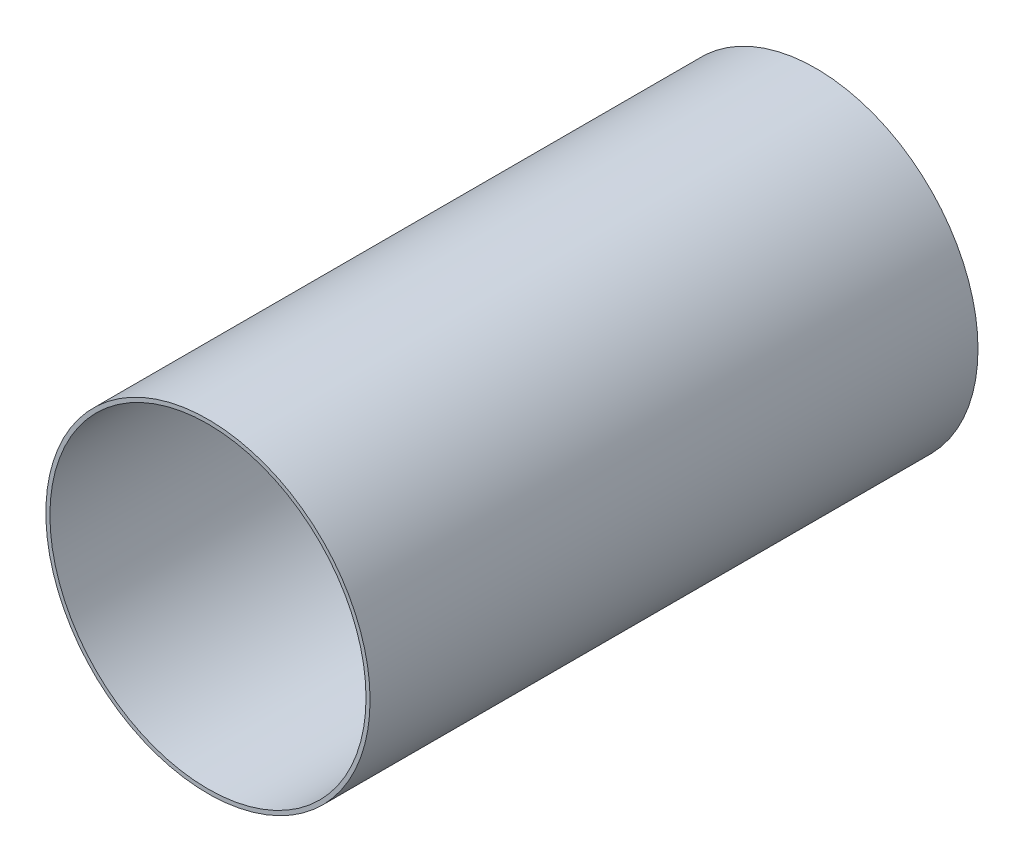
from build123d import *

# Parameters (mm, degrees)
SKETCH1_R           = 80
SKETCH1_R_2         = 78
BOSS_EXTRUDE1_DEPTH = 300


with BuildPart() as part:
    # Sketch1 → Boss-Extrude1 (new body)
    with BuildSketch(Plane.XY):
        Circle(SKETCH1_R)
        Circle(SKETCH1_R_2, mode=Mode.SUBTRACT)
    extrude(amount=BOSS_EXTRUDE1_DEPTH)


solid = part.part
